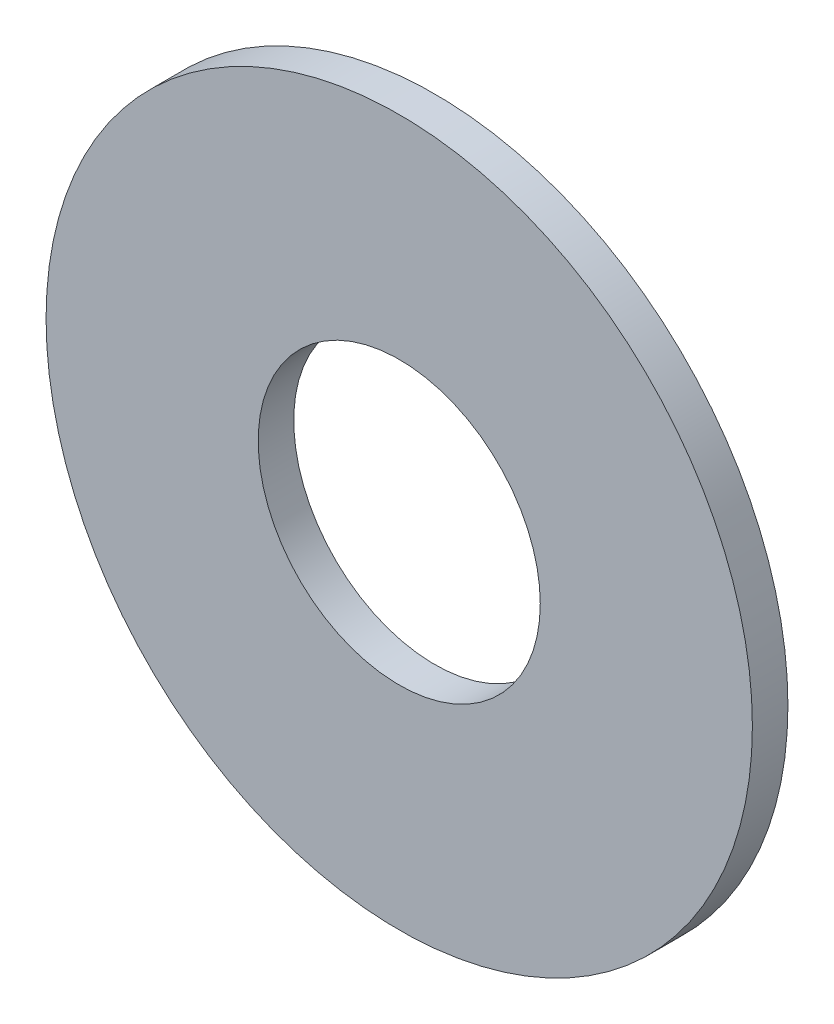
from build123d import *

# Parameters (mm, degrees)
SKETCH1_R           = 3.975
SKETCH1_R_2         = 1.5875
BOSS_EXTRUDE1_DEPTH = 0.4


with BuildPart() as part:
    # Sketch1 → Boss-Extrude1 (new body)
    with BuildSketch(Plane.XY):
        Circle(SKETCH1_R)
        Circle(SKETCH1_R_2, mode=Mode.SUBTRACT)
    extrude(amount=BOSS_EXTRUDE1_DEPTH)


solid = part.part
